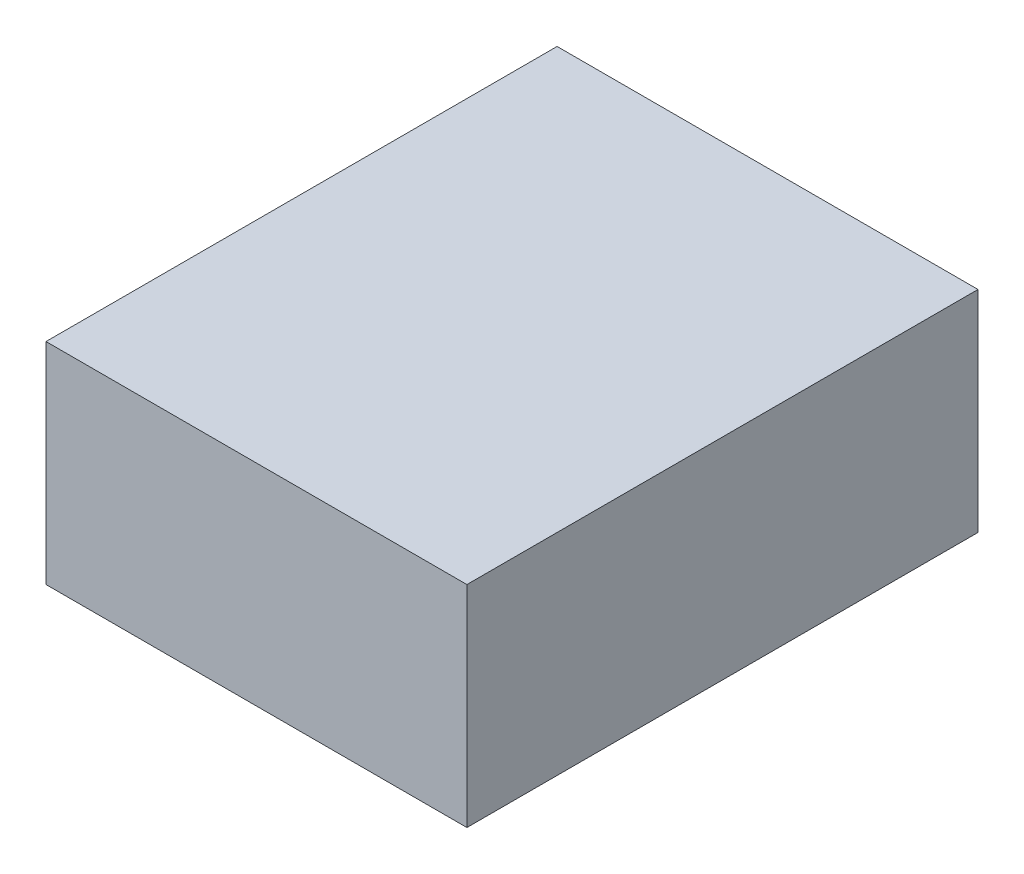
from build123d import *

# Parameters (mm, degrees)
SKETCH1_W           = 355.6
SKETCH1_H           = 431.8
BOSS_EXTRUDE1_DEPTH = 177.8


with BuildPart() as part:
    # Sketch1 → Boss-Extrude1 (new body)
    with BuildSketch(Plane(origin=(0, 0, 0), x_dir=(1, 0, 0), z_dir=(0, 1, 0))):
        Rectangle(SKETCH1_W, SKETCH1_H)
    extrude(amount=BOSS_EXTRUDE1_DEPTH)


solid = part.part
